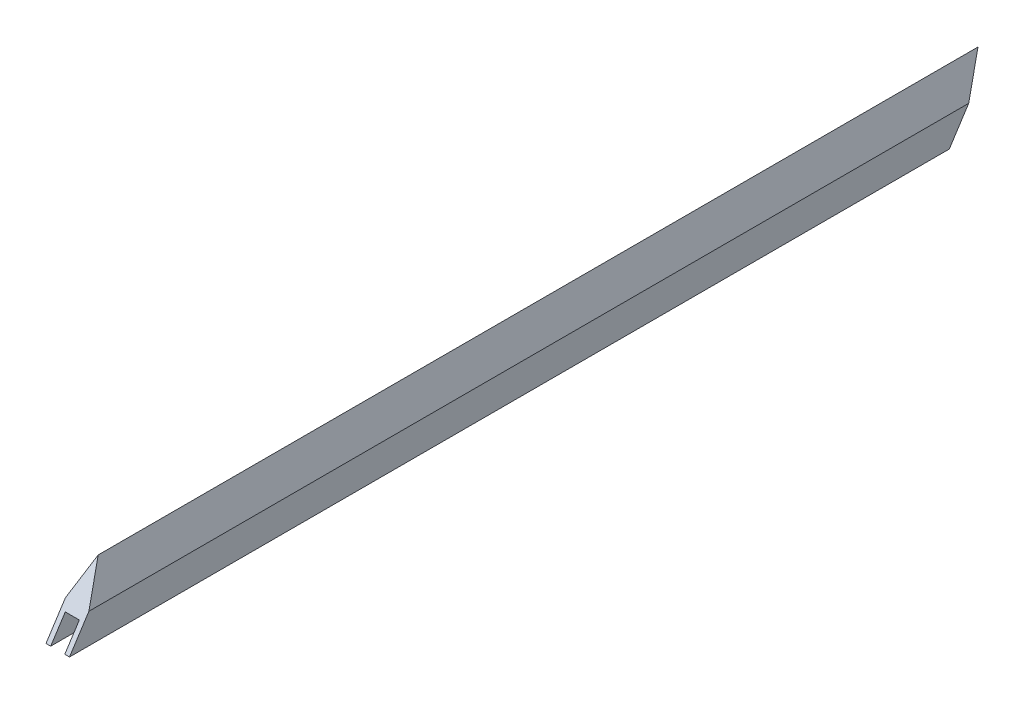
from build123d import *

# Parameters (mm, degrees)
BOSS_EXTRUDE1_DEPTH = 313.9694


with BuildPart() as part:
    # Sketch1 → Boss-Extrude1 (new body)
    with BuildSketch(Plane.XY):
        Polygon((-2.3876, 3.81), (2.3876, 3.81), (2.3876, -3.81), (3.9878, -3.81), (3.9878, 6.35), (0, 17.3609), (-3.9878, 6.35), (-3.9878, -3.81), (-2.3876, -3.81), align=None)
    extrude(amount=BOSS_EXTRUDE1_DEPTH)

    # Split1
    split(bisect_by=Plane(origin=(0, 142.217371243, 219.246784501), x_dir=(0, 0.8389556253011311, -0.5441998334946346), z_dir=(0, 0.5441998334946346, 0.8389556253011311)), keep=Keep.BOTTOM)

    # Split2
    split(bisect_by=Plane(origin=(0, 5.782993207, 8.915244702), x_dir=(0, -0.8389556253011311, 0.5441998334946346), z_dir=(0, -0.5441998334946346, -0.8389556253011311)), keep=Keep.BOTTOM)


solid = part.part
